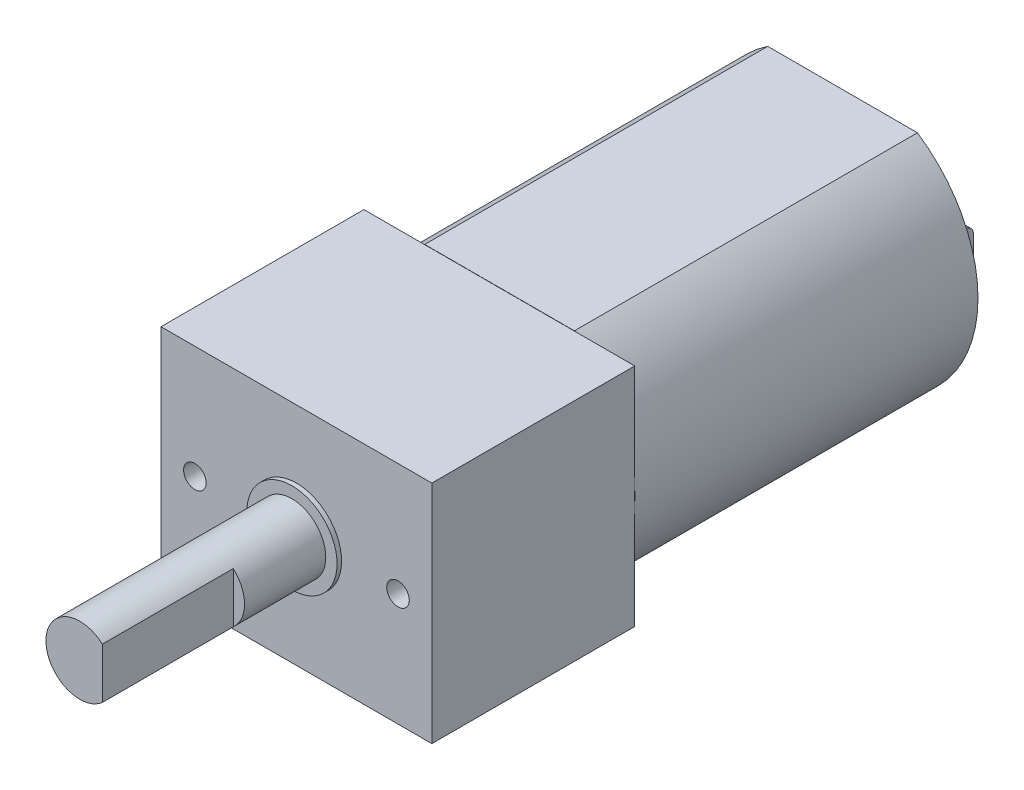
from build123d import *

# Parameters (mm, degrees)
SKETCH_1_W          = 0.3
SKETCH_1_H          = 1.5
SKETCH_1_R          = 2.5
SKETCH_1_R_2        = 1.5
EXTRUDE_1_DEPTH     = 15.2
SKETCH_1_4_W        = 0.3
SKETCH_1_4_H        = 1.5
EXTRUDE_2_DEPTH     = 2
CUT_EXTRUDE_2_DEPTH = 19.763794925
FILLET_1_R          = 0.4
SKETCH_1_5_R        = 2.5
SKETCH_1_5_R_2      = 1.5
EXTRUDE_3_DEPTH     = 1.2
CUT_EXTRUDE_START   = -1.2
SKETCH_1_7_R        = 1.5
CUT_EXTRUDE_1_DEPTH = 0.6
FILLET_2_R          = 0.4
SKETCH_3_R          = 2
EXTRUDE_4_DEPTH     = 0.5
SKETCH_3_3_R        = 0.5
EXTRUDE_5_DEPTH     = 3
SKETCH_4_R          = 0.7
SKETCH_4_R_2        = 0.5
CUT_EXTRUDE_3_DEPTH = 1
EXTRUDE_START       = 0.01
SKETCH_5_W          = 12
SKETCH_5_H          = 10
EXTRUDE_6_DEPTH     = 8.99
SKETCH_6_R          = 2
EXTRUDE_7_DEPTH     = 0.2
SKETCH_6_4_R        = 1.5
EXTRUDE_8_DEPTH     = 3.8
EXTRUDE_START_2     = 3.8
EXTRUDE_9_DEPTH     = 5.8
SKETCH_7_R          = 0.5
CUT_EXTRUDE_5_DEPTH = 5.8


with BuildPart() as part:
    # 草图1 → 凸台-拉伸1 (new body)
    # profile 1 of 5: a face of its own
    with BuildSketch(Plane.XY):
        with BuildLine():
            ThreePointArc((-6, 0), (-5.286764074, -2.837274331), (-3.31662479, -5))
            Line((-3.31662479, -5), (3.31662479, -5))
            ThreePointArc((3.31662479, -5), (5.286764074, -2.837274331), (6, 0))
            ThreePointArc((6, 0), (5.286764074, 2.837274331), (3.31662479, 5))
            Line((3.31662479, 5), (-3.31662479, 5))
            ThreePointArc((-3.31662479, 5), (-5.286764074, 2.837274331), (-6, 0))
        make_face()
        with Locations((-3.65, 0)):
            Rectangle(SKETCH_1_W, SKETCH_1_H, mode=Mode.SUBTRACT)
        Circle(SKETCH_1_R, mode=Mode.SUBTRACT)
        with Locations((3.65, 0)):
            Rectangle(SKETCH_1_W, SKETCH_1_H, mode=Mode.SUBTRACT)
    # profile 2 of 5: a face of its own
    with BuildSketch(Plane.XY):
        Circle(SKETCH_1_R)
        Circle(SKETCH_1_R_2, mode=Mode.SUBTRACT)
    # profile 3 of 5: a face of its own
    with BuildSketch(Plane.XY):
        Circle(SKETCH_1_R_2)
    # profile 4 of 5: a face of its own
    with BuildSketch(Plane.XY):
        with Locations((3.65, 0)):
            Rectangle(SKETCH_1_W, SKETCH_1_H)
    # profile 5 of 5: a face of its own
    with BuildSketch(Plane.XY):
        with Locations((-3.65, 0)):
            Rectangle(SKETCH_1_W, SKETCH_1_H)
    extrude(amount=EXTRUDE_1_DEPTH)

    # 草图1<4> → 凸台-拉伸2 (add)
    with BuildSketch(Plane.XY):
        with Locations((3.65, 0)):
            Rectangle(SKETCH_1_4_W, SKETCH_1_4_H)
        with Locations((-3.65, 0)):
            Rectangle(SKETCH_1_4_W, SKETCH_1_4_H)
    extrude(amount=-EXTRUDE_2_DEPTH)

    # 草图2 → 切除-拉伸2 (cut, through all)
    with BuildSketch(Plane(origin=(3.8, 0, 0), x_dir=(0, 0, -1), z_dir=(1, 0, 0))):
        with BuildLine():
            Line((0.95, 0.45), (1.05, 0.45))
            ThreePointArc((1.05, 0.45), (1.5, 0), (1.05, -0.45))
            Line((1.05, -0.45), (0.95, -0.45))
            ThreePointArc((0.95, -0.45), (0.5, 0), (0.95, 0.45))
        make_face()
    extrude(amount=-CUT_EXTRUDE_2_DEPTH, mode=Mode.SUBTRACT)

    # 圆角1
    fillet_1_edges = [part.edges().sort_by_distance(p)[0] for p in [
        (3.65, -0.75, -2),
        (3.65, 0.75, -2),
        (-3.65, -0.75, -2),
        (-3.65, 0.75, -2),
    ]]
    fillet(fillet_1_edges, radius=FILLET_1_R)

    # 草图1<5> → 凸台-拉伸3 (add)
    # profile 1 of 2: a face of its own
    with BuildSketch(Plane.XY):
        Circle(SKETCH_1_5_R)
        Circle(SKETCH_1_5_R_2, mode=Mode.SUBTRACT)
    # profile 2 of 2: a face of its own
    with BuildSketch(Plane.XY):
        Circle(SKETCH_1_5_R_2)
    extrude(amount=-EXTRUDE_3_DEPTH)

    # 草图1<7> → 切除-拉伸1 (cut)
    with BuildSketch(Plane.XY.offset(CUT_EXTRUDE_START)):
        Circle(SKETCH_1_7_R)
    extrude(amount=CUT_EXTRUDE_1_DEPTH, mode=Mode.SUBTRACT)

    # 圆角2
    fillet_2_edges = [part.edges().sort_by_distance(p)[0] for p in [
        (-2.5, 0, -1.2),
    ]]
    fillet(fillet_2_edges, radius=FILLET_2_R)

    # 草图3 → 凸台-拉伸4 (add)
    with BuildSketch(Plane.XY.offset(15.2)):
        Circle(SKETCH_3_R)
    extrude(amount=EXTRUDE_4_DEPTH)

    # 草图3<3> → 凸台-拉伸5 (add)
    with BuildSketch(Plane.XY.offset(15.2)):
        Circle(SKETCH_3_3_R)
    extrude(amount=EXTRUDE_5_DEPTH)

    # 草图4 → 切除-拉伸3 (cut)
    with BuildSketch(Plane.XY.offset(15.2)):
        with Locations((-4.25, 0)):
            Circle(SKETCH_4_R)
        with Locations((4.25, 0)):
            Circle(SKETCH_4_R)
        with Locations((0, 3.5)):
            Circle(SKETCH_4_R_2)
    extrude(amount=-CUT_EXTRUDE_3_DEPTH, mode=Mode.SUBTRACT)

    # 草图5 → 凸台-拉伸6 (add)
    with BuildSketch(Plane.XY.offset(15.2).offset(EXTRUDE_START)):
        Rectangle(SKETCH_5_W, SKETCH_5_H)
    extrude(amount=EXTRUDE_6_DEPTH)

    # 草图6 → 凸台-拉伸7 (add)
    with BuildSketch(Plane.XY.offset(24.2)):
        Circle(SKETCH_6_R)
    extrude(amount=EXTRUDE_7_DEPTH)

    # 草图6<4> → 凸台-拉伸8 (add)
    with BuildSketch(Plane.XY.offset(24.2)):
        Circle(SKETCH_6_4_R)
    extrude(amount=EXTRUDE_8_DEPTH)

    # 草图6<5> → 凸台-拉伸9 (add)
    with BuildSketch(Plane.XY.offset(24.2).offset(EXTRUDE_START_2)):
        with BuildLine():
            Line((1, -1.118033989), (1, 1.118033989))
            ThreePointArc((1, 1.118033989), (-1.5, 0), (1, -1.118033989))
        make_face()
    extrude(amount=EXTRUDE_9_DEPTH)

    # 草图7 → 切除-拉伸5 (cut)
    with BuildSketch(Plane.XY.offset(24.2)):
        with Locations((-4.5, 0)):
            Circle(SKETCH_7_R)
        with Locations((4.5, 0)):
            Circle(SKETCH_7_R)
    extrude(amount=-CUT_EXTRUDE_5_DEPTH, mode=Mode.SUBTRACT)


solid = part.part
